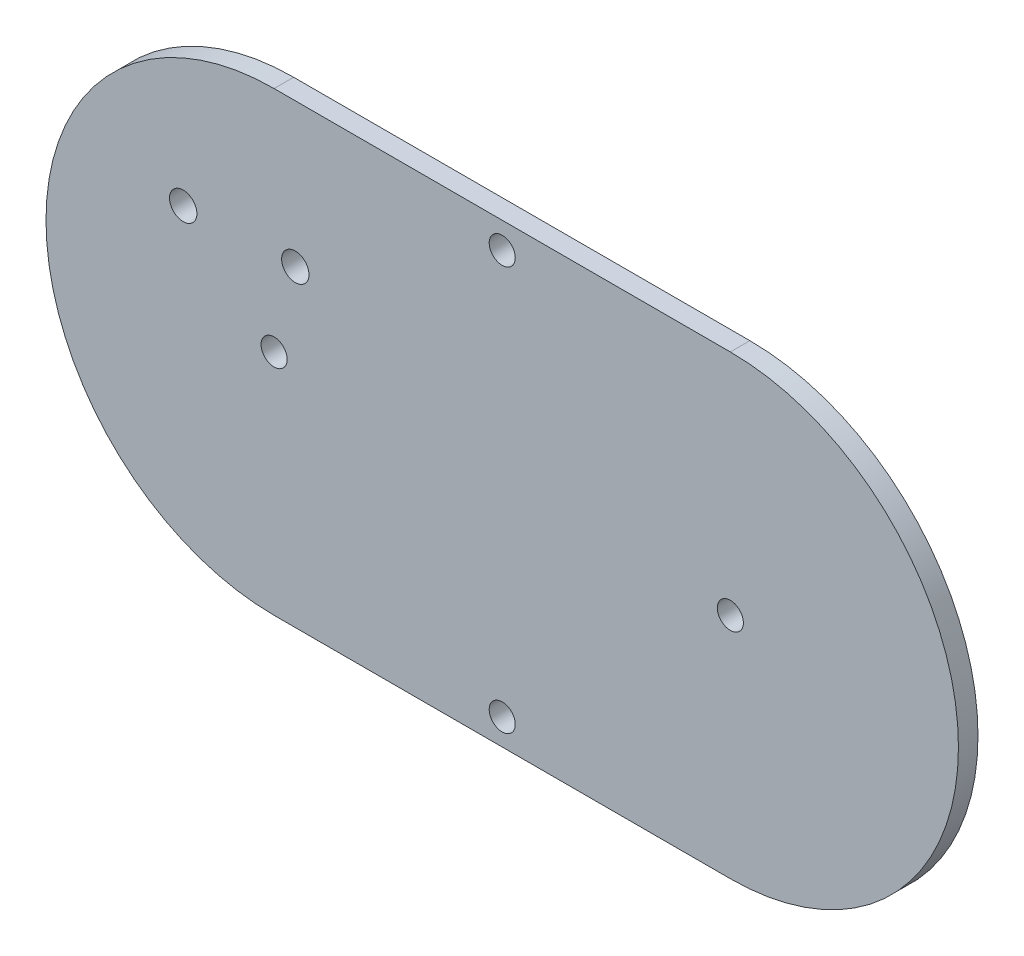
from build123d import *

# Parameters (mm, degrees)
SKETCH1_R           = 2
SKETCH1_R_2         = 2.099997394
SKETCH1_R_3         = 2.100000418
BOSS_EXTRUDE1_DEPTH = 3


with BuildPart() as part:
    # Sketch1 → Boss-Extrude1 (new body)
    with BuildSketch(Plane.XY):
        with BuildLine():
            Line((243.514566495, 346.287321237), (313.514566495, 346.287321237))
            ThreePointArc((313.514566495, 346.287321237), (348.514566495, 311.287321237), (313.514566495, 276.287321237))
            Line((313.514566495, 276.287321237), (243.514566495, 276.287321237))
            ThreePointArc((243.514566495, 276.287321237), (208.514566495, 311.287321237), (243.514566495, 346.287321237))
        make_face()
        with Locations((243.514566495, 311.287321237)):
            Circle(SKETCH1_R, mode=Mode.SUBTRACT)
        with Locations((313.514566495, 311.287321237)):
            Circle(SKETCH1_R, mode=Mode.SUBTRACT)
        with Locations((246.764562225, 324.225588056)):
            Circle(SKETCH1_R_2, mode=Mode.SUBTRACT)
        with Locations((229.564568056, 323.725595013)):
            Circle(SKETCH1_R_3, mode=Mode.SUBTRACT)
        with Locations((278.514566495, 342.287321237)):
            Circle(SKETCH1_R, mode=Mode.SUBTRACT)
        with Locations(Location((278.514566495, 280.287321237, 0), (0, 0, 180))):
            Circle(SKETCH1_R, mode=Mode.SUBTRACT)
    extrude(amount=BOSS_EXTRUDE1_DEPTH)


solid = part.part
